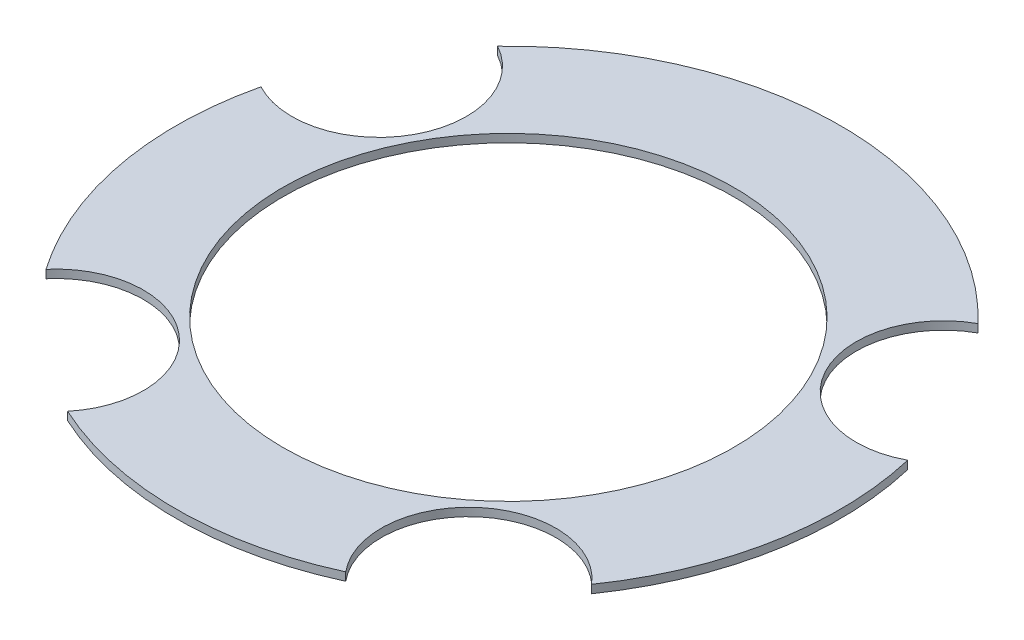
from build123d import *

# Parameters (mm, degrees)
SKETCH1_R           = 40.538
SKETCH1_R_2         = 27.506
BOSS_EXTRUDE1_DEPTH = 1
SKETCH4_R           = 10.65
CUT_EXTRUDE1_DEPTH  = 1


with BuildPart() as part:
    # Sketch1 → Boss-Extrude1 (new body)
    with BuildSketch(Plane(origin=(0, 0, 0), x_dir=(-1, 0, 0), z_dir=(0, 1, 0))):
        with Locations(Location((-29.391570254, 2.611368154, 0), (0, 0, 90))):
            Circle(SKETCH1_R)
        with Locations(Location((-29.391570254, 2.611368154, 0), (0, 0, 90))):
            Circle(SKETCH1_R_2, mode=Mode.SUBTRACT)
    extrude(amount=BOSS_EXTRUDE1_DEPTH)

    # Sketch4 → Cut-Extrude1 (cut)
    with BuildSketch(Plane.XZ):
        with Locations((4.223815401, 32.628524909)):
            Circle(SKETCH4_R)
        with Locations((54.559325107, 32.628524909)):
            Circle(SKETCH4_R)
        with Locations((63.829694025, -16.055747722)):
            Circle(SKETCH4_R)
        with Locations((-5.046553517, -16.055747722)):
            Circle(SKETCH4_R)
    extrude(amount=-CUT_EXTRUDE1_DEPTH, mode=Mode.SUBTRACT)


solid = part.part
